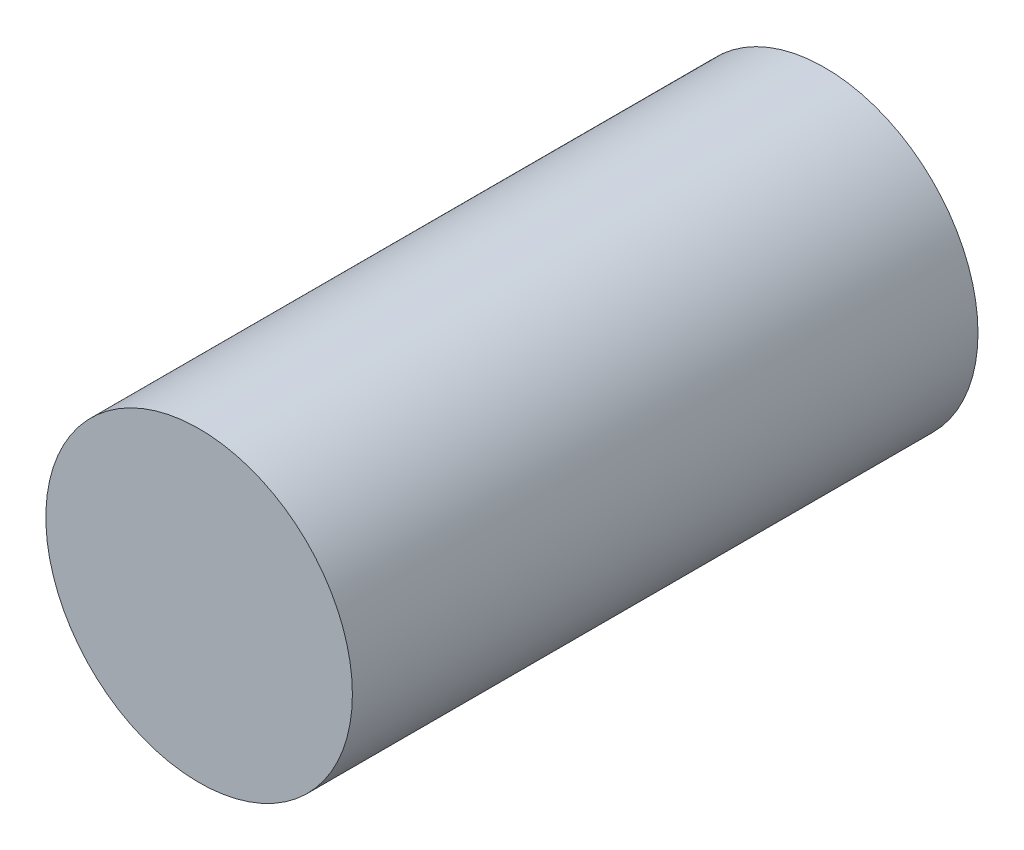
from build123d import *

# Parameters (mm, degrees)
SKETCH_1_R      = 4.9
EXTRUDE_1_DEPTH = 20


with BuildPart() as part:
    # 草图1 → 凸台-拉伸1 (new body)
    with BuildSketch(Plane.XY):
        Circle(SKETCH_1_R)
    extrude(amount=EXTRUDE_1_DEPTH)


solid = part.part
